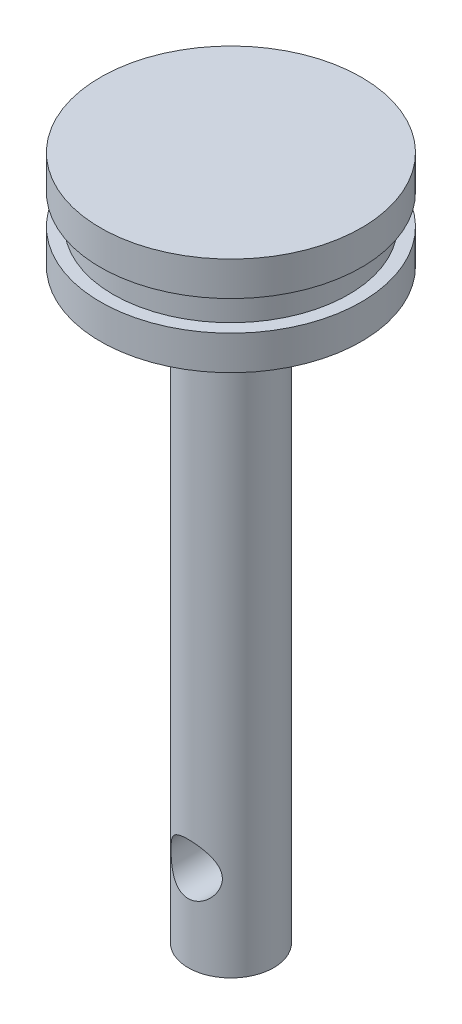
from build123d import *

# Parameters (mm, degrees)
CUT_EXTRUDE1_REACH                  = 84.856
CUT_EXTRUDE1_END_RADIUS             = 5
SKETCH3_R                           = 3
CUT_EXTRUDE1_DIRECTION_2_REACH      = 84.856
CUT_EXTRUDE1_DIRECTION_2_END_RADIUS = 5


with BuildPart() as part:
    # Sketch1 → Revolve2 (revolve)
    with BuildSketch(Plane.XY, mode=Mode.PRIVATE) as revolve2_sk:
        Polygon((0, 0), (0, 80), (15.25, 80), (15.25, 76), (13.75, 76), (13.75, 72.5), (15.25, 72.5), (15.25, 68.5), (5, 68.5), (5, 0), align=None)
    revolve(revolve2_sk.sketch.rotate(Axis((0, 0, 0), (0, 1, 0)), 90), axis=Axis((0, 0, 0), (0, 1, 0)))

    # Cut-Extrude1: up to this cylinder (the profile starts inside it)
    cut_extrude1_end = Plane(origin=(0, 10, 0), z_dir=(0, -1, 0)) * Cylinder(CUT_EXTRUDE1_END_RADIUS, 180.712, mode=Mode.PRIVATE)
    # Sketch3 → Cut-Extrude1 (cut, up to the surface)
    with BuildSketch(Plane.XY, mode=Mode.PRIVATE) as cut_extrude1_sk1:
        with Locations(Location((0, 10, 0), (0, 0, 180))):
            Circle(SKETCH3_R)
    cut_extrude1_tool1 = extrude(cut_extrude1_sk1.sketch, amount=-CUT_EXTRUDE1_REACH, mode=Mode.PRIVATE) & cut_extrude1_end
    add(cut_extrude1_tool1.solids().sort_by_distance((0, 10, 0))[0], mode=Mode.SUBTRACT)

    # Cut-Extrude1 direction 2: up to this cylinder (the profile starts inside it)
    cut_extrude1_direction_2_end = Plane(origin=(0, 10, 0), z_dir=(0, -1, 0)) * Cylinder(CUT_EXTRUDE1_DIRECTION_2_END_RADIUS, 180.712, mode=Mode.PRIVATE)
    # Sketch3 → Cut-Extrude1 direction 2 (cut, up to the surface)
    with BuildSketch(Plane.XY, mode=Mode.PRIVATE) as cut_extrude1_direction_2_sk1:
        with Locations(Location((0, 10, 0), (0, 0, 180))):
            Circle(SKETCH3_R)
    cut_extrude1_direction_2_tool1 = extrude(cut_extrude1_direction_2_sk1.sketch, amount=CUT_EXTRUDE1_DIRECTION_2_REACH, mode=Mode.PRIVATE) & cut_extrude1_direction_2_end
    add(cut_extrude1_direction_2_tool1.solids().sort_by_distance((0, 10, 0))[0], mode=Mode.SUBTRACT)


solid = part.part
